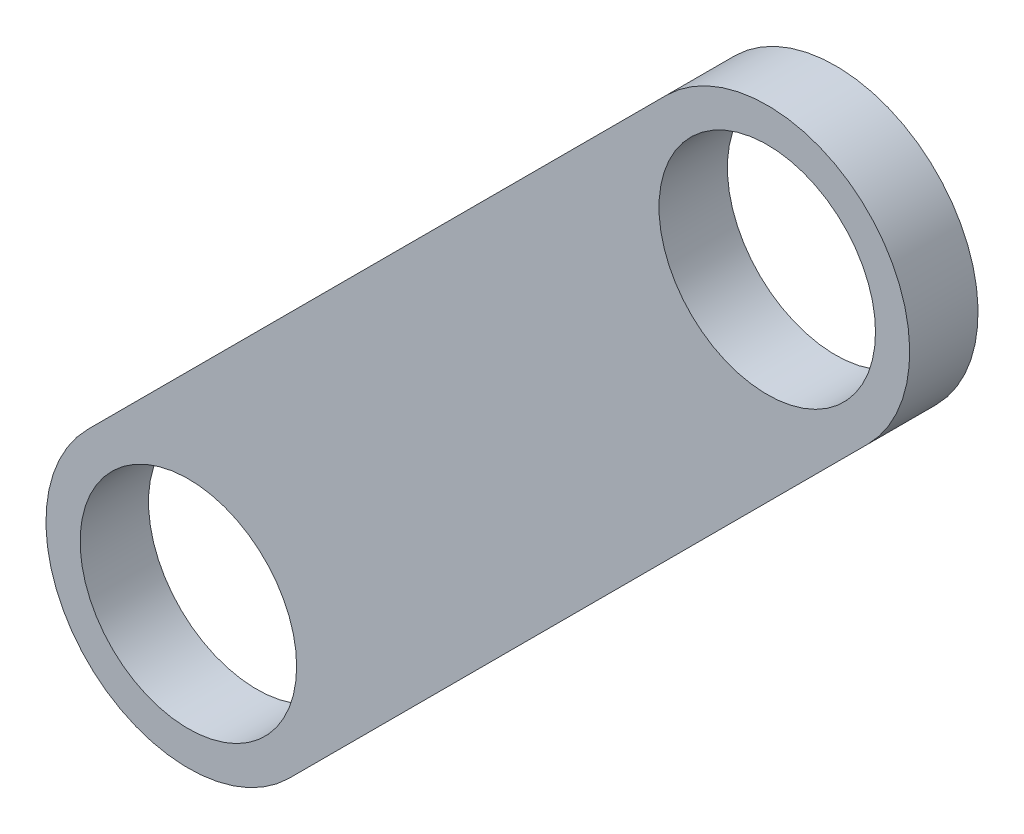
from build123d import *

# Parameters (mm, degrees)
SKETCH1_R           = 9.5
BOSS_EXTRUDE1_DEPTH = 6


with BuildPart() as part:
    # Sketch1 → Boss-Extrude1 (new body)
    with BuildSketch(Plane.XY):
        with BuildLine():
            Line((-8.838834765, 8.838834765), (41.961165235, 59.638834765))
            ThreePointArc((41.961165235, 59.638834765), (59.638834765, 59.638834765), (59.638834765, 41.961165235))
            Line((59.638834765, 41.961165235), (8.838834765, -8.838834765))
            ThreePointArc((8.838834765, -8.838834765), (-8.838834765, -8.838834765), (-8.838834765, 8.838834765))
        make_face()
        Circle(SKETCH1_R, mode=Mode.SUBTRACT)
        with Locations((50.8, 50.8)):
            Circle(SKETCH1_R, mode=Mode.SUBTRACT)
    extrude(amount=BOSS_EXTRUDE1_DEPTH)


solid = part.part
